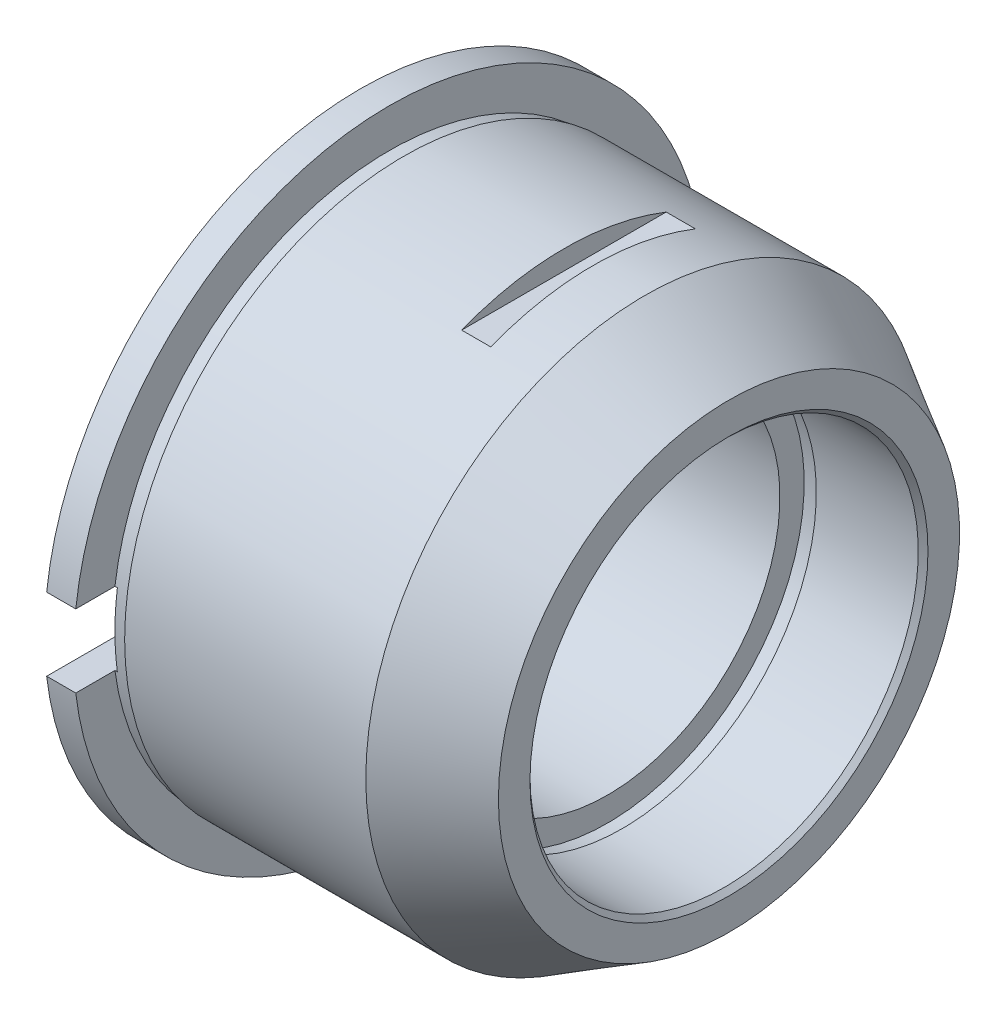
from build123d import *

# Parameters (mm, degrees)
CUT_EXTRUDE_1_DEPTH      = 120.272796563
CUT_EXTRUDE_1_DEPTH_BACK = 120.272796563
SKETCH_2_W               = 6
SKETCH_2_H               = 4
SKETCH_2_W_2             = 6.5
SKETCH_2_H_2             = 15


with BuildPart() as part:
    # Эскиз1 → Повернуть1 (revolve)
    with BuildSketch(Plane.XY, mode=Mode.PRIVATE) as revolve_1_sk:
        Polygon((0, 39), (6, 39), (6, 35.5), (51, 35.5), (51, 40.5), (54, 40.5), (54, 40), (75, 40), (76, 41), (76, 47.5), (58.679491924, 57.5), (9, 57.5), (9, 57), (6, 57), (6, 65), (0, 65), align=None)
    revolve(revolve_1_sk.sketch.rotate(Axis((0, 0, 0), (1, 0, 0)), 90), axis=Axis((0, 0, 0), (1, 0, 0)))

    # Эскиз2 → Вырез-Вытянуть1 (cut, two sides: drawn at the far end of the back side and taken through both)
    with BuildSketch(Plane.XY.offset(-CUT_EXTRUDE_1_DEPTH_BACK)):
        with Locations((45, 55.5)):
            Rectangle(SKETCH_2_W, SKETCH_2_H)
        with Locations((3.25, 0)):
            Rectangle(SKETCH_2_W_2, SKETCH_2_H_2)
    extrude(amount=CUT_EXTRUDE_1_DEPTH + CUT_EXTRUDE_1_DEPTH_BACK, mode=Mode.SUBTRACT)


solid = part.part
